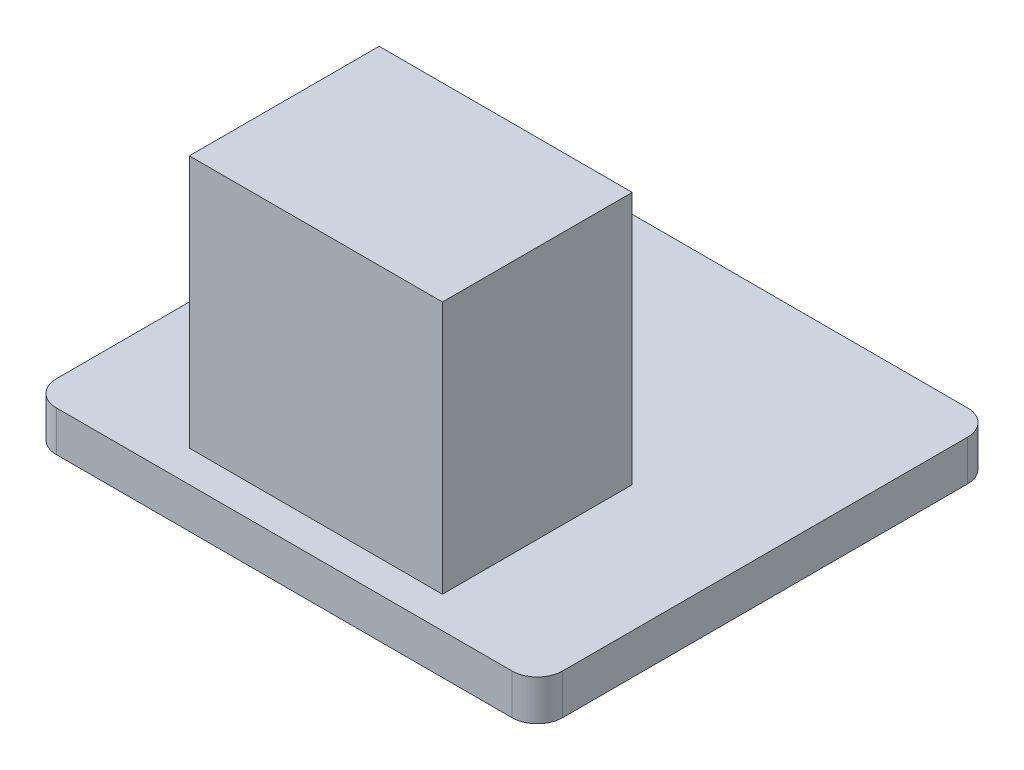
from build123d import *

# Parameters (mm, degrees)
BOARD_START    = 10
BOARD_DEPTH    = 1.6
TERMINAL_START = 11.6
SKETCH2_W      = 10
SKETCH2_H      = 7.5
TERMINAL_DEPTH = 10


with BuildPart() as part:
    # Sketch1 → Board (new body)
    with BuildSketch(Plane(origin=(0, 0, 0), x_dir=(1, 0, 0), z_dir=(0, 1, 0)).offset(BOARD_START)):
        with BuildLine():
            Line((-56, -21), (-38, -21))
            ThreePointArc((-38, -21), (-37.292893219, -21.292893219), (-37, -22))
            Line((-37, -22), (-37, -38))
            ThreePointArc((-37, -38), (-37.292893219, -38.707106781), (-38, -39))
            Line((-38, -39), (-56, -39))
            ThreePointArc((-56, -39), (-56.707106781, -38.707106781), (-57, -38))
            Line((-57, -38), (-57, -22))
            ThreePointArc((-57, -22), (-56.707106781, -21.292893219), (-56, -21))
        make_face()
    extrude(amount=BOARD_DEPTH)

    # Sketch2 → Terminal (add)
    with BuildSketch(Plane(origin=(0, 0, 0), x_dir=(1, 0, 0), z_dir=(0, 1, 0)).offset(TERMINAL_START)):
        with Locations((-47, -34)):
            Rectangle(SKETCH2_W, SKETCH2_H)
    extrude(amount=TERMINAL_DEPTH)


solid = part.part
